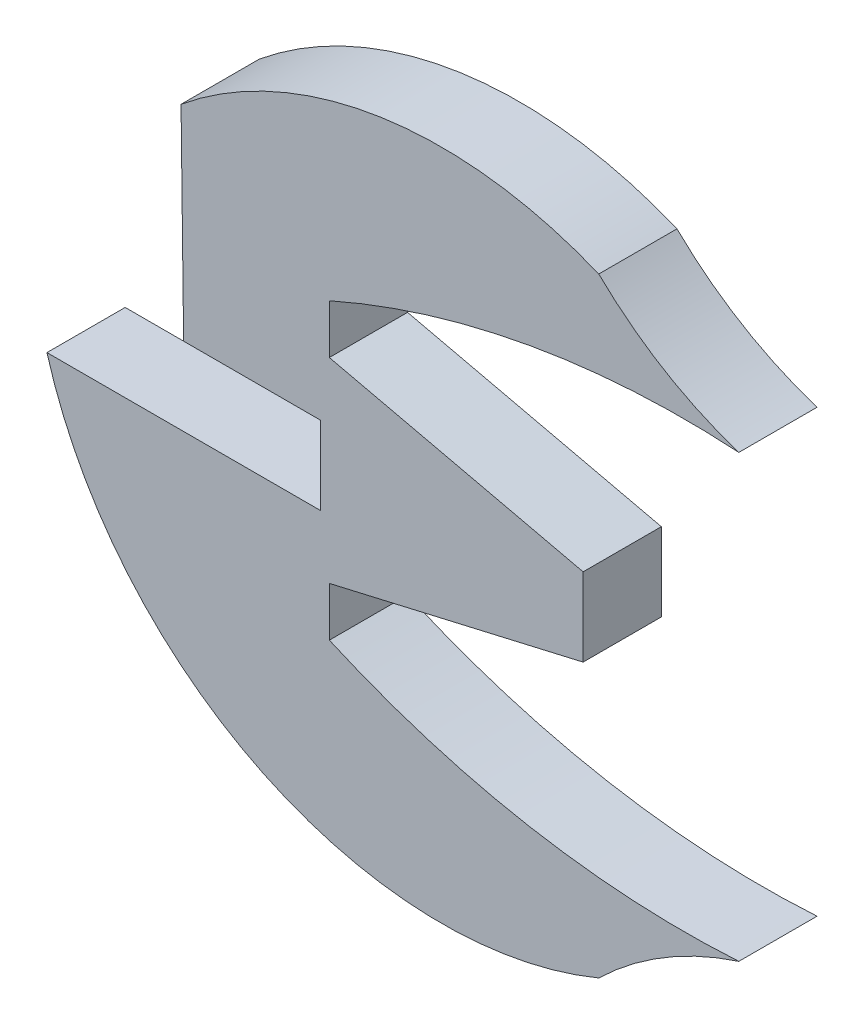
from build123d import *

# Parameters (mm, degrees)
BOSS_EXTRUDE1_DEPTH = 1.524


with BuildPart() as part:
    # Sketch1 → Boss-Extrude1 (new body)
    with BuildSketch(Plane.XY):
        with BuildLine():
            Line((41.68481024, 0), (41.68481024, -1.524))
            Line((41.68481024, -1.524), (36.357969238, -1.524))
            ThreePointArc((36.357969238, -1.524), (40.575187599, -6.520629639), (47.11110588, -6.702318062))
            ThreePointArc((47.11110588, -6.702318062), (48.381195539, -5.722313338), (49.840736605, -5.056522921))
            ThreePointArc((49.840736605, -5.056522921), (45.764525456, -4.822424484), (41.860759392, -3.626218014))
            Line((41.860759392, -3.626218014), (41.860759392, -2.667580322))
            Line((41.860759392, -2.667580322), (46.80618972, -1.524))
            Line((46.80618972, -1.524), (46.80618972, 0))
            Line((46.80618972, 0), (41.860759392, 1.143580322))
            Line((41.860759392, 1.143580322), (41.860759392, 2.102218014))
            ThreePointArc((41.860759392, 2.102218014), (45.764525456, 3.298424484), (49.840736605, 3.532522921))
            ThreePointArc((49.840736605, 3.532522921), (48.381195539, 4.198313338), (47.11110588, 5.178318062))
            ThreePointArc((47.11110588, 5.178318062), (42.874226953, 5.702520491), (38.97108533, 3.972949241))
            Line((38.97108533, 3.972949241), (39.021389739, 0))
            Line((39.021389739, 0), (41.68481024, 0))
        make_face()
    extrude(amount=BOSS_EXTRUDE1_DEPTH)


solid = part.part
